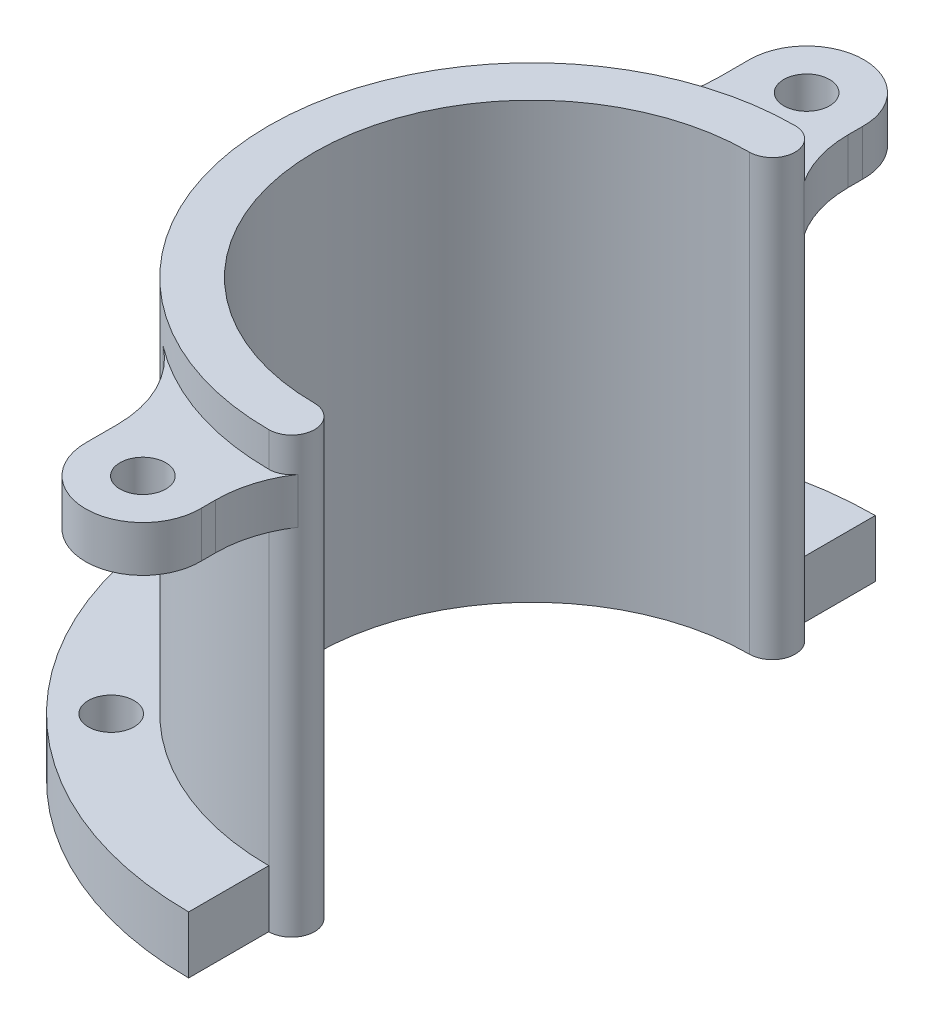
from build123d import *

# Parameters (mm, degrees)
BOSS_EXTRUDE1_DEPTH = 38
BOSS_EXTRUDE2_DEPTH = 5
SKETCH3_R           = 2
CUT_EXTRUDE1_DEPTH  = 5
BOSS_EXTRUDE3_START = -4
BOSS_EXTRUDE3_DEPTH = 4
SKETCH5_R           = 2
CUT_EXTRUDE2_DEPTH  = 4
FILLET1_R           = 10


with BuildPart() as part:
    # Sketch1 → Boss-Extrude1 (new body)
    with BuildSketch(Plane(origin=(0, 0, 0), x_dir=(1, 0, 0), z_dir=(0, 1, 0))):
        with BuildLine():
            ThreePointArc((0, 23), (-23, 0), (0, -23))
            ThreePointArc((0, -23), (2, -21), (0, -19))
            ThreePointArc((0, -19), (-19, 0), (0, 19))
            ThreePointArc((0, 19), (2, 21), (0, 23))
        make_face()
    extrude(amount=BOSS_EXTRUDE1_DEPTH)

    # Sketch2 → Boss-Extrude2 (add)
    with BuildSketch(Plane(origin=(0, 0, 0), x_dir=(1, 0, 0), z_dir=(0, 1, 0))):
        with BuildLine():
            Line((0, 30), (0, 23))
            ThreePointArc((0, 23), (-23, 0), (0, -23))
            Line((0, -23), (0, -30))
            ThreePointArc((0, -30), (-30, 0), (0, 30))
        make_face()
    extrude(amount=BOSS_EXTRUDE2_DEPTH)

    # Sketch3 → Cut-Extrude1 (cut)
    with BuildSketch(Plane(origin=(0, 0, 0), x_dir=(-1, 0, 0), z_dir=(0, -1, 0))):
        with Locations(Location((18.384776311, -18.384776311, 0), (0, 0, 90))):
            Circle(SKETCH3_R)
    cut_extrude1 = extrude(amount=-CUT_EXTRUDE1_DEPTH, mode=Mode.SUBTRACT)

    # Mirror1: Cut-Extrude1 across plane
    add(cut_extrude1.mirror(Plane.XY), mode=Mode.SUBTRACT)

    # Sketch4 → Boss-Extrude3 (add)
    with BuildSketch(Plane(origin=(0, 35, 0), x_dir=(1, 0, 0), z_dir=(0, 1, 0)).offset(BOSS_EXTRUDE3_START)):
        with BuildLine():
            Line((0, 28.877875957), (0, 23))
            ThreePointArc((0, 23), (-5.128361746, 22.420970224), (-9.998508349, 20.713035287))
            Line((-9.998508349, 20.713035287), (-9.998508349, 29))
            ThreePointArc((-9.998508349, 29), (-4.937441773, 33.999627073), (0, 28.877875957))
        make_face()
    boss_extrude3 = extrude(amount=BOSS_EXTRUDE3_DEPTH)

    # Sketch5 → Cut-Extrude2 (cut)
    with BuildSketch(Plane.XZ.offset(-31)):
        with Locations(Location((-4.998508349, -29, 0), (0, 0, 270))):
            Circle(SKETCH5_R)
    cut_extrude2 = extrude(amount=-CUT_EXTRUDE2_DEPTH, mode=Mode.SUBTRACT)

    # Mirror2: Boss-Extrude3, Cut-Extrude2 across plane
    add(boss_extrude3.mirror(Plane.XY))
    add(cut_extrude2.mirror(Plane.XY), mode=Mode.SUBTRACT)

    # Fillet1
    fillet1_edges = [part.edges().sort_by_distance(p)[0] for p in [
        (0, 33, -23),
        (-9.998508349, 33, -20.713035287),
        (-9.998508349, 33, 20.713035287),
        (0, 33, 23),
    ]]
    fillet(fillet1_edges, radius=FILLET1_R)


solid = part.part
